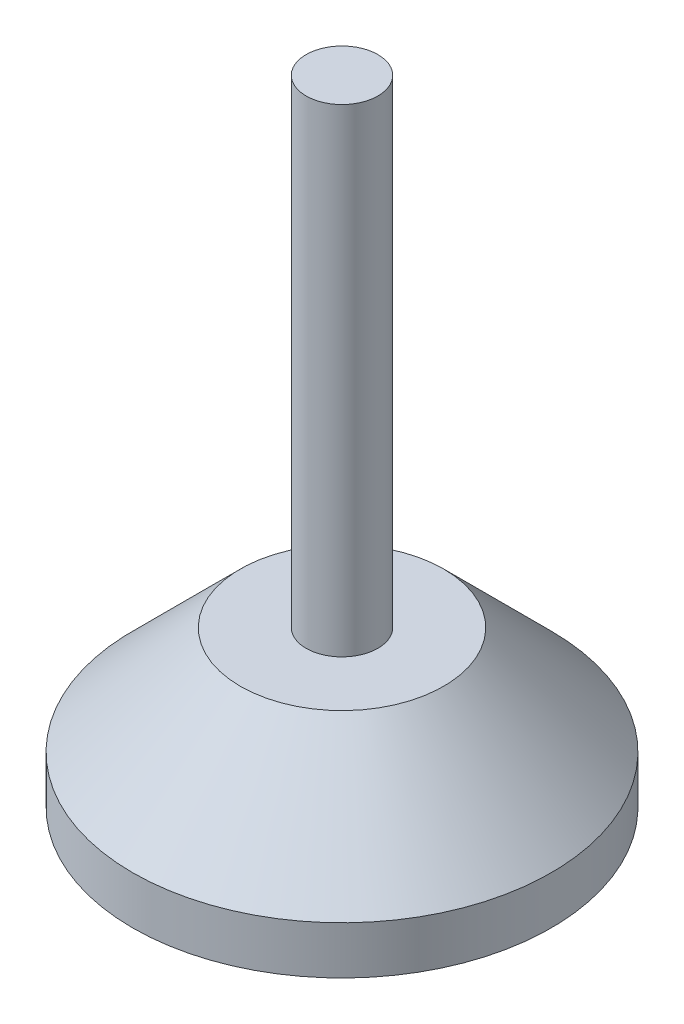
from build123d import *


with BuildPart() as part:
    # Sketch1 → Revolve1 (revolve)
    with BuildSketch(Plane(origin=(0, 0, 0), x_dir=(0, 0, -1), z_dir=(1, 0, 0))):
        Polygon((0, 0), (27.78125, 0), (27.78125, 6.35), (13.49375, 20.6375), (4.7625, 20.6375), (4.7625, 84.1375), (0, 84.1375), align=None)
    revolve(axis=Axis((0, 0.745681745, 0), (0, 1, 0)))


solid = part.part
